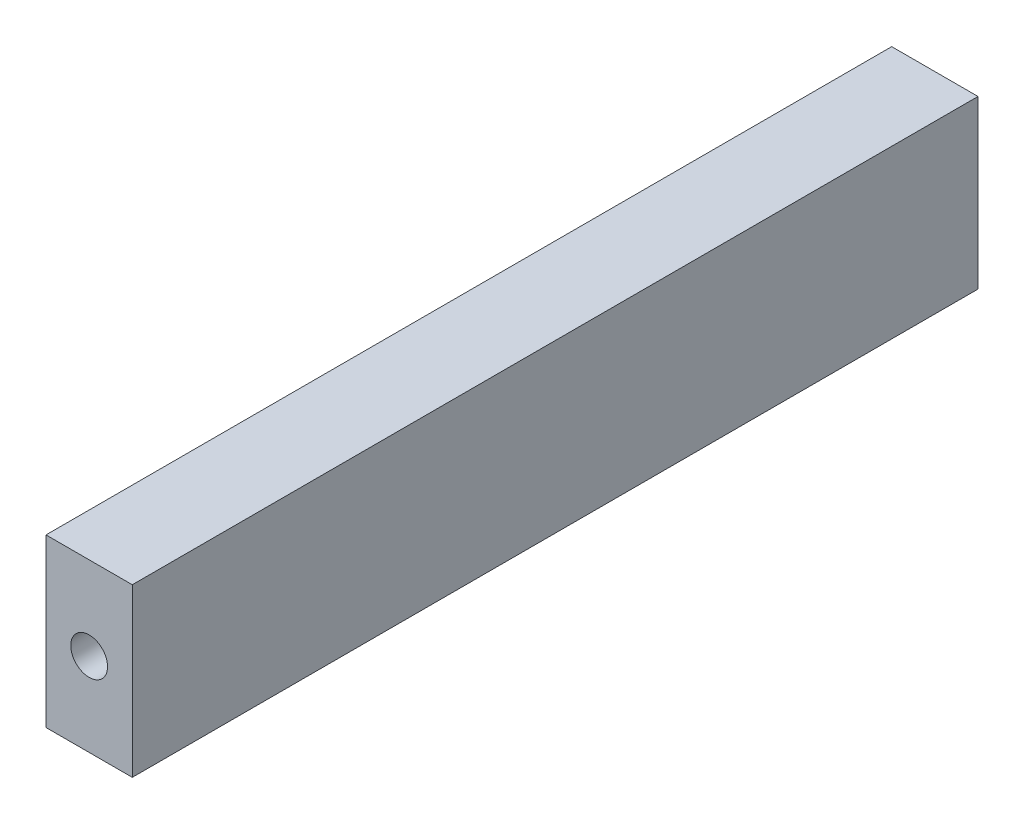
from build123d import *

# Parameters (mm, degrees)
SKETCH1_W           = 15
SKETCH1_H           = 29
BOSS_EXTRUDE1_DEPTH = 147
SKETCH2_R           = 3.2
CUT_EXTRUDE1_DEPTH  = 9.5


with BuildPart() as part:
    # Sketch1 → Boss-Extrude1 (new body)
    with BuildSketch(Plane.XY):
        with Locations((-34.484924623, 20.173366834)):
            Rectangle(SKETCH1_W, SKETCH1_H)
    extrude(amount=BOSS_EXTRUDE1_DEPTH)

    # Sketch2 → Cut-Extrude1 (cut)
    with BuildSketch(Plane.XY.offset(147)):
        with Locations((-34.484924623, 20.173366834)):
            Circle(SKETCH2_R)
    cut_extrude1 = extrude(amount=-CUT_EXTRUDE1_DEPTH, mode=Mode.SUBTRACT)

    # Mirror1: Cut-Extrude1 across plane
    add(cut_extrude1.mirror(Plane.XY.offset(73.5)), mode=Mode.SUBTRACT)


solid = part.part
